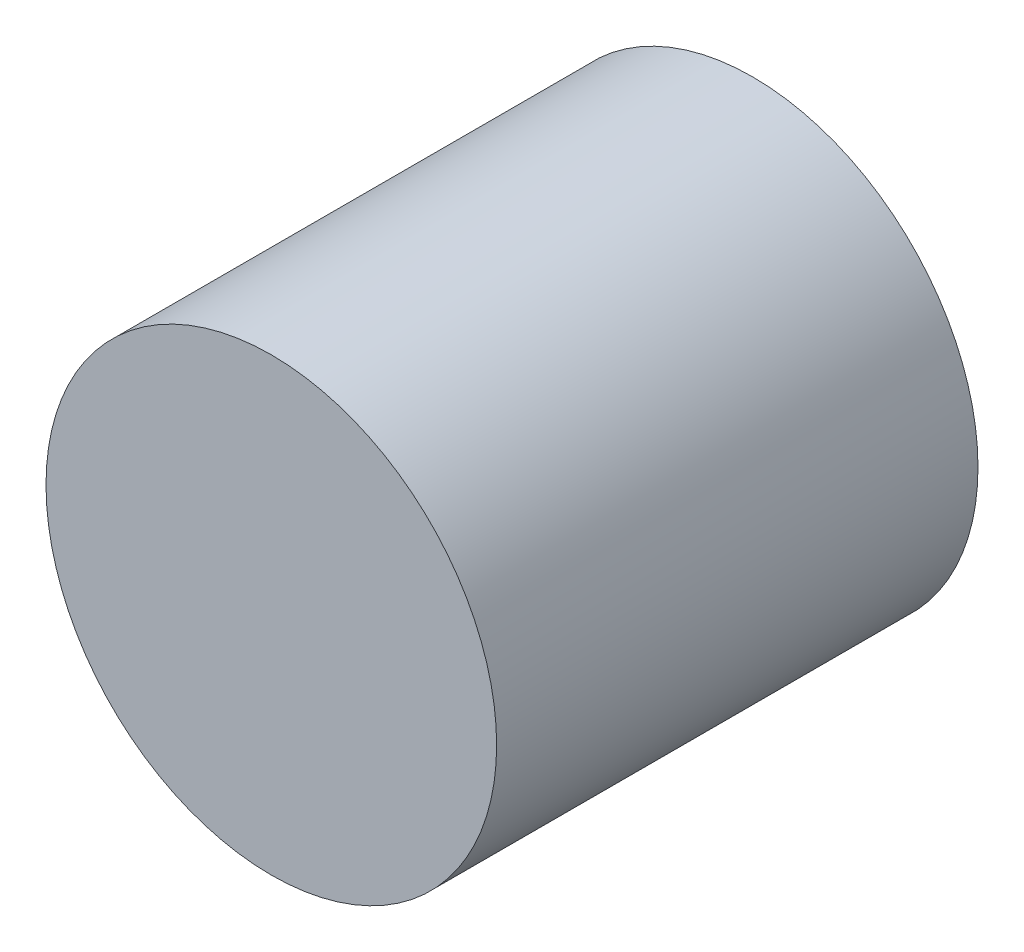
from build123d import *

# Parameters (mm, degrees)
SKETCH1_R           = 5.588
BOSS_EXTRUDE1_DEPTH = 11.938


with BuildPart() as part:
    # Sketch1 → Boss-Extrude1 (new body)
    with BuildSketch(Plane.XY):
        Circle(SKETCH1_R)
    extrude(amount=BOSS_EXTRUDE1_DEPTH)


solid = part.part
